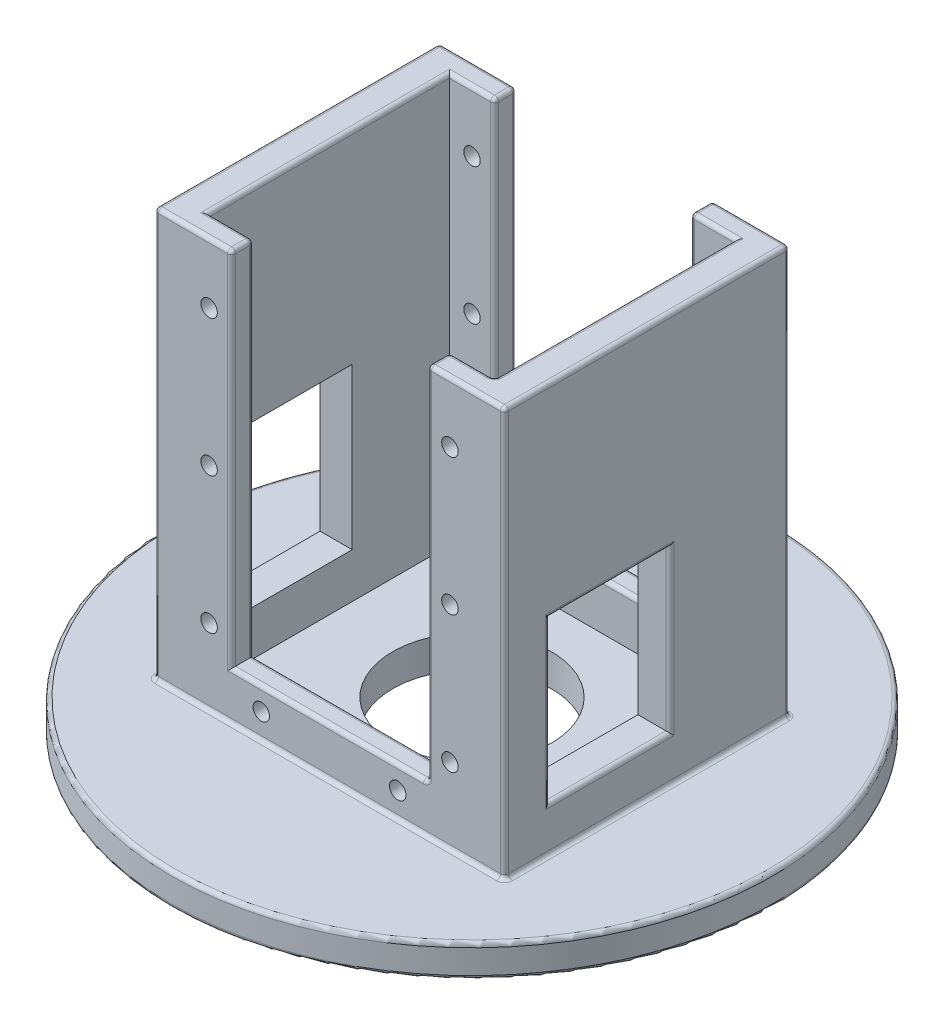
from build123d import *

# Parameters (mm, degrees)
SKETCH1_R           = 37.5
BOSS_EXTRUDE1_DEPTH = 4
SKETCH2_R           = 9.879229091
CUT_EXTRUDE1_DEPTH  = 83.614522064
SKETCH3_W           = 30.000000003
SKETCH3_H           = 50.890860003
BOSS_EXTRUDE2_DEPTH = 4
SKETCH4_W           = 2.749999997
SKETCH4_H           = 50.890860003
BOSS_EXTRUDE3_DEPTH = 9.6
SKETCH5_W           = 30.000000003
SKETCH5_H           = 50.890860003
BOSS_EXTRUDE4_DEPTH = 4
BOSS_EXTRUDE5_START = -9.6
SKETCH6_W           = 2.749998353
SKETCH6_H           = 50.890860003
SKETCH6_W_2         = 2.749999997
BOSS_EXTRUDE5_DEPTH = 9.6
SKETCH7_W           = 24.4
SKETCH7_H           = 2.749999997
SKETCH7_H_2         = 2.749998353
BOSS_EXTRUDE6_DEPTH = 5.890860005
SKETCH9_R           = 1.025
CUT_EXTRUDE2_DEPTH  = 76.29234718
SKETCH10_W          = 15
SKETCH10_H          = 20
CUT_EXTRUDE3_DEPTH  = 79.312611015
FILLET1_R           = 0.5


with BuildPart() as part:
    # Sketch1 → Boss-Extrude1 (new body)
    with BuildSketch(Plane(origin=(0, -34.786851595, 0), x_dir=(1, 0, 0), z_dir=(0, 1, 0))):
        with Locations(Location((0, 0, 0), (0, 0, 270))):
            Circle(SKETCH1_R)
    extrude(amount=BOSS_EXTRUDE1_DEPTH)

    # Sketch2 → Cut-Extrude1 (cut, through all)
    with BuildSketch(Plane(origin=(-36.004484597, -30.786851595, 0), x_dir=(1, 0, 0), z_dir=(0, 1, 0))):
        with Locations(Location((36.004484597, 0, 0), (0, 0, 270))):
            Circle(SKETCH2_R)
    extrude(amount=-CUT_EXTRUDE1_DEPTH, mode=Mode.SUBTRACT)

    # Sketch3 → Boss-Extrude2 (add)
    with BuildSketch(Plane(origin=(17.8, 0, 0), x_dir=(0, 0, -1), z_dir=(1, 0, 0))):
        with Locations((-1e-09, -5.341421593)):
            Rectangle(SKETCH3_W, SKETCH3_H)
    extrude(amount=BOSS_EXTRUDE2_DEPTH)

    # Sketch4 → Boss-Extrude3 (add)
    with BuildSketch(Plane(origin=(21.8, 0, 0), x_dir=(0, 0, -1), z_dir=(1, 0, 0))):
        with Locations((-16.375000001, -5.341421593)):
            Rectangle(SKETCH4_W, SKETCH4_H)
        Polygon((15, 20.104008408), (17.749998353, 20.104008408), (17.749998353, -30.786851595), (15, -30.786851595), align=None)
    extrude(amount=-BOSS_EXTRUDE3_DEPTH)

    # Sketch5 → Boss-Extrude4 (add)
    with BuildSketch(Plane.ZY.offset(17.8)):
        with Locations((1e-09, -5.341421593)):
            Rectangle(SKETCH5_W, SKETCH5_H)
    extrude(amount=BOSS_EXTRUDE4_DEPTH)

    # Sketch6 → Boss-Extrude5 (add)
    with BuildSketch(Plane.ZY.offset(21.8).offset(BOSS_EXTRUDE5_START)):
        with Locations((-16.374999177, -5.341421593)):
            Rectangle(SKETCH6_W, SKETCH6_H)
        with Locations((16.375000001, -5.341421593)):
            Rectangle(SKETCH6_W_2, SKETCH6_H)
    extrude(amount=BOSS_EXTRUDE5_DEPTH)

    # Sketch7 → Boss-Extrude6 (add)
    with BuildSketch(Plane(origin=(-36.004484597, -30.786851595, 0), x_dir=(1, 0, 0), z_dir=(0, 1, 0))):
        with Locations((36.004484597, -16.375000001)):
            Rectangle(SKETCH7_W, SKETCH7_H)
        with Locations((36.004484597, 16.374999177)):
            Rectangle(SKETCH7_W, SKETCH7_H_2)
    extrude(amount=BOSS_EXTRUDE6_DEPTH)

    # Sketch9 → Cut-Extrude2 (cut, through all)
    with BuildSketch(Plane.XY.offset(17.75)):
        with Locations((-15, 12.60400841)):
            Circle(SKETCH9_R)
        with Locations((-15, -4.39599159)):
            Circle(SKETCH9_R)
        with Locations((-15, -21.39599159)):
            Circle(SKETCH9_R)
        with Locations((-8.5, -27.69599159)):
            Circle(SKETCH9_R)
        with Locations((8.5, -27.69599159)):
            Circle(SKETCH9_R)
        with Locations((15, -21.39599159)):
            Circle(SKETCH9_R)
        with Locations((15, -4.39599159)):
            Circle(SKETCH9_R)
        with Locations((15, 12.60400841)):
            Circle(SKETCH9_R)
    extrude(amount=-CUT_EXTRUDE2_DEPTH, mode=Mode.SUBTRACT)

    # Sketch10 → Cut-Extrude3 (cut, through all)
    with BuildSketch(Plane(origin=(21.8, 0, 0), x_dir=(0, 0, -1), z_dir=(1, 0, 0))):
        with Locations((-4.62749624, -15.186851595)):
            Rectangle(SKETCH10_W, SKETCH10_H)
    extrude(amount=-CUT_EXTRUDE3_DEPTH, mode=Mode.SUBTRACT)

    # Fillet1
    fillet1_edges = [part.edges().sort_by_distance(p)[0] for p in [
        (0, -24.89599159, -15),
        (0, -24.89599159, 15.000000003),
        (0, -24.89599159, 17.75),
        (0, -30.786851595, -17.749998353),
        (-12.2, -2.395991591, -15),
        (-12.2, -2.395991591, -17.749998353),
        (-12.2, -24.89599159, -16.374999176),
        (-15, 20.104008408, 15.000000003),
        (-12.2, 20.104008408, 16.375000002),
        (-17, 20.104008408, 17.75),
        (-17, 20.104008408, -17.749998353),
        (-12.2, 20.104008408, -16.374999176),
        (-15, 20.104008408, -15),
        (-17.8, 20.104008408, 2e-09),
        (-21.8, -5.341421594, 17.75),
        (-21.8, -30.786851595, 8.24e-07),
        (21.8, -30.786851595, 8.24e-07),
        (-21.8, -5.341421594, -17.749998353),
        (21.8, 20.104008408, 8.24e-07),
        (-21.8, 20.104008408, 8.24e-07),
        (12.2, -2.395991591, -17.749998353),
        (12.2, -2.395991591, -15),
        (12.2, -24.89599159, -16.374999176),
        (12.2, -2.395991591, 15.000000003),
        (12.2, -2.395991591, 17.75),
        (12.2, -24.89599159, 16.375000002),
        (15, 20.104008408, -15),
        (12.2, 20.104008408, -16.374999176),
        (17, 20.104008408, -17.749998353),
        (17, 20.104008408, 17.75),
        (12.2, 20.104008408, 16.375000002),
        (15, 20.104008408, 15.000000003),
        (17.8, 20.104008408, 2e-09),
        (21.8, -5.341421594, -17.749998353),
        (21.8, -5.341421594, 17.75),
        (21.8, -25.186851595, 4.62749624),
        (21.8, -15.186851595, -2.87250376),
        (21.8, -5.186851595, 4.62749624),
        (21.8, -15.186851595, 12.12749624),
        (0, -30.786851595, -37.5),
        (-12.2, -2.395991591, 15.000000003),
        (-12.2, -2.395991591, 17.75),
        (0, -24.89599159, -17.749998353),
        (0, -34.786851595, -37.5),
        (17.8, -5.341421594, 15.000000003),
        (0, -30.786851595, 17.75),
    ]]
    fillet(fillet1_edges, radius=FILLET1_R)


solid = part.part
